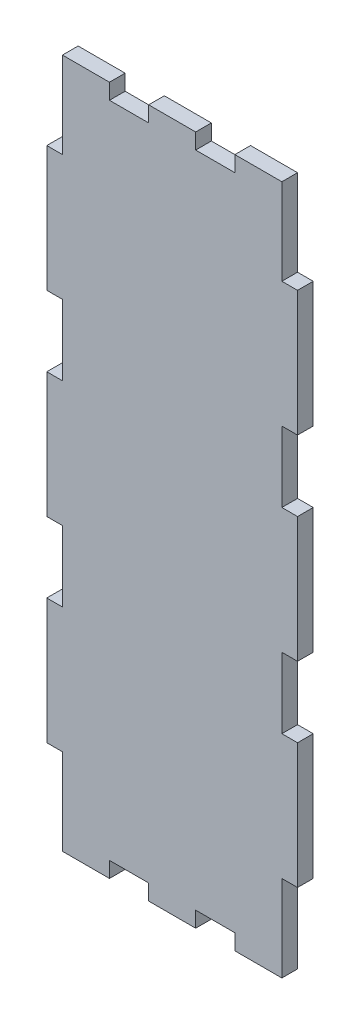
from build123d import *

# Parameters (mm, degrees)
SKETCH1_W               = 56
SKETCH1_H               = 4
BOSS_EXTRUDE1_DEPTH     = 168
SKETCH3_W               = 4
SKETCH3_H               = 32
BOSS_EXTRUDE4_DEPTH     = 4
LPATTERN2_COUNT         = 3
LPATTERN2_PITCH         = 50
MIRROR2_COPY_1_SKETCH_W = 4
MIRROR2_COPY_1_SKETCH_H = 32
MIRROR2_COPY_1_DEPTH    = 4
MIRROR2_COPY_2_SKETCH_W = 4
MIRROR2_COPY_2_SKETCH_H = 32
MIRROR2_COPY_2_DEPTH    = 4
SKETCH4_W               = 12
SKETCH4_H               = 4
BOSS_EXTRUDE5_DEPTH     = 4


with BuildPart() as part:
    # Sketch1 → Boss-Extrude1 (new body)
    with BuildSketch(Plane(origin=(0, 0, 0), x_dir=(1, 0, 0), z_dir=(0, 1, 0))):
        Rectangle(SKETCH1_W, SKETCH1_H)
    extrude(amount=BOSS_EXTRUDE1_DEPTH)

    # Sketch3 → Boss-Extrude4 (add, through all)
    with BuildSketch(Plane.XY.offset(2)):
        with Locations((-30, 34)):
            Rectangle(SKETCH3_W, SKETCH3_H)
    boss_extrude4 = extrude(amount=-BOSS_EXTRUDE4_DEPTH)

    # LPattern2: Boss-Extrude4 ×3
    with Locations(*[(0, i * LPATTERN2_PITCH, 0) for i in range(1, LPATTERN2_COUNT)]):
        add(boss_extrude4)

    # Mirror2: Boss-Extrude4 across plane
    add(boss_extrude4.mirror(Plane(origin=(0, 0, 0), x_dir=(0, 0, 1), z_dir=(1, 0, 0))))

    # Mirror2 copy 1 sketch → Mirror2 copy 1 (add, through all)
    with BuildSketch(Plane(origin=(0, 50, 2), x_dir=(-1, 0, 0), z_dir=(0, 0, 1))):
        with Locations((-30, -34)):
            Rectangle(MIRROR2_COPY_1_SKETCH_W, MIRROR2_COPY_1_SKETCH_H)
    extrude(amount=-MIRROR2_COPY_1_DEPTH)

    # Mirror2 copy 2 sketch → Mirror2 copy 2 (add, through all)
    with BuildSketch(Plane(origin=(0, 100, 2), x_dir=(-1, 0, 0), z_dir=(0, 0, 1))):
        with Locations((-30, -34)):
            Rectangle(MIRROR2_COPY_2_SKETCH_W, MIRROR2_COPY_2_SKETCH_H)
    extrude(amount=-MIRROR2_COPY_2_DEPTH)

    # Sketch4 → Boss-Extrude5 (add, through all)
    with BuildSketch(Plane.XY.offset(2)):
        with Locations((-22, 170)):
            Rectangle(SKETCH4_W, SKETCH4_H)
        with Locations((0, 170)):
            Rectangle(SKETCH4_W, SKETCH4_H)
        with Locations((22, 170)):
            Rectangle(SKETCH4_W, SKETCH4_H)
    boss_extrude5 = extrude(amount=-BOSS_EXTRUDE5_DEPTH)

    # Mirror3: Boss-Extrude5 across plane
    add(boss_extrude5.mirror(Plane.ZX.offset(84)))


solid = part.part
